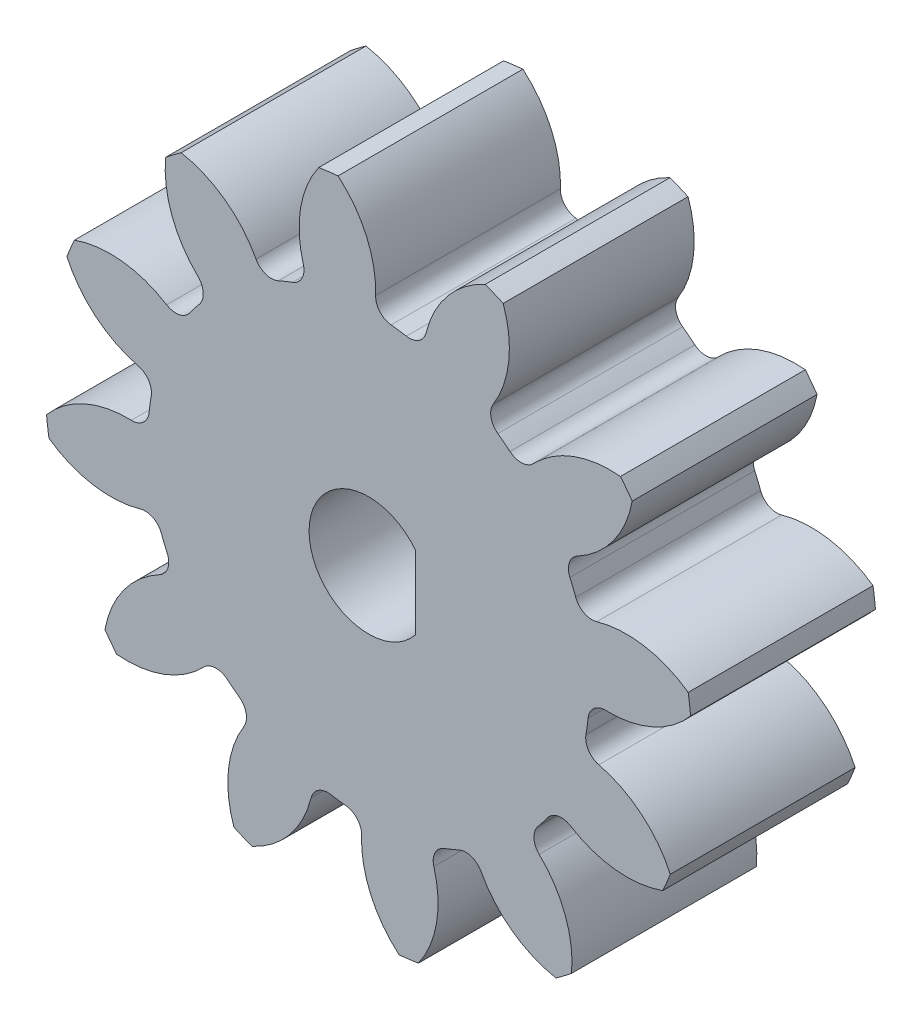
from build123d import *

# Parameters (mm, degrees)
SKETCH3_R          = 14
GEARBODY_DEPTH     = 8
TOOTHCUT_DEPTH     = 22.354156504
CIRPATTERN1_COUNT  = 12
CUT_EXTRUDE1_DEPTH = 8
CHAMFER1_SIZE      = 1


with BuildPart() as part:
    # Sketch3 → gearBody (new body)
    with BuildSketch(Plane.XY):
        Circle(SKETCH3_R)
    extrude(amount=GEARBODY_DEPTH)

    # Sketch2 → toothCut (cut, through all)
    with BuildSketch(Plane.XY):
        with BuildLine():
            ThreePointArc((9.407882888, -1.636752947), (9.459378184, -1.306669437), (9.499295851, -0.974986654))
            ThreePointArc((9.499295851, -0.974986654), (9.751264317, -0.488083012), (10.267616219, -0.303844098))
            ThreePointArc((10.267616219, -0.303844098), (12.510323629, 0.19449452), (14.235972761, 1.711139825))
            ThreePointArc((14.235972761, 1.711139825), (14.203571583, -1.962007706), (13.238980983, -5.506387425))
            ThreePointArc((13.238980983, -5.506387425), (11.989111429, -3.578719403), (9.965486694, -2.491051791))
            ThreePointArc((9.965486694, -2.491051791), (9.51841766, -2.173730906), (9.407882888, -1.636752947))
        make_face()
    toothcut = extrude(amount=TOOTHCUT_DEPTH, mode=Mode.SUBTRACT)

    # CirPattern1: toothCut ×12 about axis
    cirpattern1_axis = Axis((0, 0, 0), (0, 0, 1))
    for i in range(1, CIRPATTERN1_COUNT):
        add(toothcut.rotate(cirpattern1_axis, i * 360 / CIRPATTERN1_COUNT), mode=Mode.SUBTRACT)

    # hub1Dia → Cut-Extrude1 (cut)
    with BuildSketch(Plane(origin=(0, 0, 0), x_dir=(-1, 0, 0), z_dir=(0, 0, -1))):
        with BuildLine():
            Line((-2.025, -1.590597372), (-2.025, 1.590597372))
            ThreePointArc((-2.025, 1.590597372), (2.575, 0), (-2.025, -1.590597372))
        make_face()
    extrude(amount=-CUT_EXTRUDE1_DEPTH, mode=Mode.SUBTRACT)

    # Chamfer1
    chamfer1_edges = [part.edges().sort_by_distance(p)[0] for p in [
        (-2.575, 0, 0),
        (2.025, 0, 0),
    ]]
    chamfer(chamfer1_edges, length=CHAMFER1_SIZE)


solid = part.part
